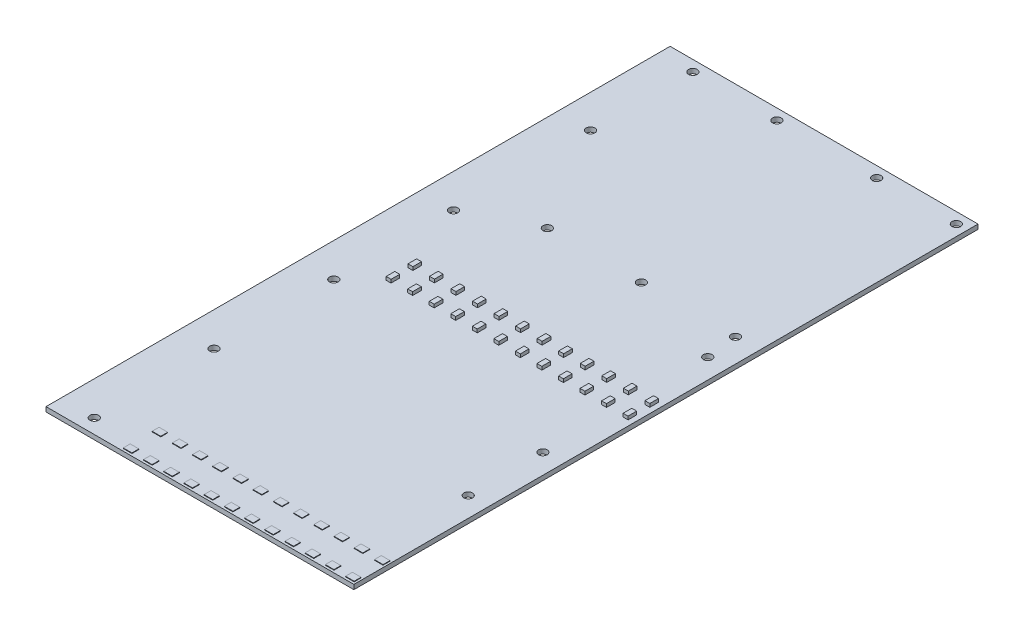
from build123d import *

# Parameters (mm, degrees)
SKETCH1_W           = 106.67
SKETCH1_H           = 216.23
BOSS_EXTRUDE1_DEPTH = 1.6
SKETCH6_W           = 3
SKETCH6_H           = 2.4
BOSS_EXTRUDE3_DEPTH = 0.2
SKETCH13_W          = 1.7
SKETCH13_H          = 3
BOSS_EXTRUDE4_DEPTH = 1.15
SKETCH14_R          = 1.5
CUT_EXTRUDE1_DEPTH  = 121.586226203
SKETCH15_R          = 1.5
CUT_EXTRUDE2_DEPTH  = 121.586226203


with BuildPart() as part:
    # Sketch1 → Boss-Extrude1 (new body)
    with BuildSketch(Plane(origin=(0, 0, 0), x_dir=(1, 0, 0), z_dir=(0, 1, 0))):
        Rectangle(SKETCH1_W, SKETCH1_H)
    extrude(amount=BOSS_EXTRUDE1_DEPTH)

    # Sketch6 → Boss-Extrude3 (add)
    with BuildSketch(Plane.XZ):
        with Locations((-25.865, 106.115)):
            Rectangle(SKETCH6_W, SKETCH6_H)
        with Locations((-25.865, 96.115)):
            Rectangle(SKETCH6_W, SKETCH6_H)
        with Locations((-18.865, 106.115)):
            Rectangle(SKETCH6_W, SKETCH6_H)
        with Locations((-18.865, 96.115)):
            Rectangle(SKETCH6_W, SKETCH6_H)
        with Locations((-11.865, 106.115)):
            Rectangle(SKETCH6_W, SKETCH6_H)
        with Locations((-11.865, 96.115)):
            Rectangle(SKETCH6_W, SKETCH6_H)
        with Locations((-4.865, 106.115)):
            Rectangle(SKETCH6_W, SKETCH6_H)
        with Locations((-4.865, 96.115)):
            Rectangle(SKETCH6_W, SKETCH6_H)
        with Locations((2.135, 106.115)):
            Rectangle(SKETCH6_W, SKETCH6_H)
        with Locations((2.135, 96.115)):
            Rectangle(SKETCH6_W, SKETCH6_H)
        with Locations((9.135, 106.115)):
            Rectangle(SKETCH6_W, SKETCH6_H)
        with Locations((9.135, 96.115)):
            Rectangle(SKETCH6_W, SKETCH6_H)
        with Locations((16.135, 106.115)):
            Rectangle(SKETCH6_W, SKETCH6_H)
        with Locations((16.135, 96.115)):
            Rectangle(SKETCH6_W, SKETCH6_H)
        with Locations((23.135, 106.115)):
            Rectangle(SKETCH6_W, SKETCH6_H)
        with Locations((23.135, 96.115)):
            Rectangle(SKETCH6_W, SKETCH6_H)
        with Locations((30.135, 106.115)):
            Rectangle(SKETCH6_W, SKETCH6_H)
        with Locations((30.135, 96.115)):
            Rectangle(SKETCH6_W, SKETCH6_H)
        with Locations((37.135, 106.115)):
            Rectangle(SKETCH6_W, SKETCH6_H)
        with Locations((37.135, 96.115)):
            Rectangle(SKETCH6_W, SKETCH6_H)
        with Locations((44.135, 106.115)):
            Rectangle(SKETCH6_W, SKETCH6_H)
        with Locations((44.135, 96.115)):
            Rectangle(SKETCH6_W, SKETCH6_H)
        with Locations((51.135, 106.115)):
            Rectangle(SKETCH6_W, SKETCH6_H)
        with Locations((51.135, 96.115)):
            Rectangle(SKETCH6_W, SKETCH6_H)
    boss_extrude3 = extrude(amount=BOSS_EXTRUDE3_DEPTH)

    # Mirror2: Boss-Extrude3 across plane
    add(boss_extrude3.mirror(Plane(origin=(0, 0.8, 0), x_dir=(0, 0, 1), z_dir=(0, -1, 0))))

    # Sketch13 → Boss-Extrude4 (add)
    with BuildSketch(Plane(origin=(0, 1.6, 0), x_dir=(1, 0, 0), z_dir=(0, 1, 0))):
        with Locations((43.161363636, -2.225)):
            Rectangle(SKETCH13_W, SKETCH13_H)
        with Locations((50.625, -2.225)):
            Rectangle(SKETCH13_W, SKETCH13_H)
        with Locations((35.697727273, -2.225)):
            Rectangle(SKETCH13_W, SKETCH13_H)
        with Locations((28.234090909, -2.225)):
            Rectangle(SKETCH13_W, SKETCH13_H)
        with Locations((20.770454545, -2.225)):
            Rectangle(SKETCH13_W, SKETCH13_H)
        with Locations((13.306818182, -2.225)):
            Rectangle(SKETCH13_W, SKETCH13_H)
        with Locations((5.843181818, -2.225)):
            Rectangle(SKETCH13_W, SKETCH13_H)
        with Locations((-1.620454545, -2.225)):
            Rectangle(SKETCH13_W, SKETCH13_H)
        with Locations((-9.084090909, -2.225)):
            Rectangle(SKETCH13_W, SKETCH13_H)
        with Locations((-16.547727273, -2.225)):
            Rectangle(SKETCH13_W, SKETCH13_H)
        with Locations((-24.011363636, -2.225)):
            Rectangle(SKETCH13_W, SKETCH13_H)
        with Locations((-31.475, -2.225)):
            Rectangle(SKETCH13_W, SKETCH13_H)
        with Locations((-31.475, -9.775)):
            Rectangle(SKETCH13_W, SKETCH13_H)
        with Locations((-24.011363636, -9.775)):
            Rectangle(SKETCH13_W, SKETCH13_H)
        with Locations((-16.547727273, -9.775)):
            Rectangle(SKETCH13_W, SKETCH13_H)
        with Locations((-9.084090909, -9.775)):
            Rectangle(SKETCH13_W, SKETCH13_H)
        with Locations((-1.620454545, -9.775)):
            Rectangle(SKETCH13_W, SKETCH13_H)
        with Locations((5.843181818, -9.775)):
            Rectangle(SKETCH13_W, SKETCH13_H)
        with Locations((13.306818182, -9.775)):
            Rectangle(SKETCH13_W, SKETCH13_H)
        with Locations((20.770454545, -9.775)):
            Rectangle(SKETCH13_W, SKETCH13_H)
        with Locations((28.234090909, -9.775)):
            Rectangle(SKETCH13_W, SKETCH13_H)
        with Locations((35.697727273, -9.775)):
            Rectangle(SKETCH13_W, SKETCH13_H)
        with Locations((43.161363636, -9.775)):
            Rectangle(SKETCH13_W, SKETCH13_H)
        with Locations((50.625, -9.775)):
            Rectangle(SKETCH13_W, SKETCH13_H)
    boss_extrude4 = extrude(amount=BOSS_EXTRUDE4_DEPTH)

    # Mirror3: Boss-Extrude4 across plane
    add(boss_extrude4.mirror(Plane(origin=(0, 0.8, 0), x_dir=(0, 0, 1), z_dir=(0, -1, 0))))

    # Sketch14 → Cut-Extrude1 (cut, through all)
    with BuildSketch(Plane(origin=(0, 1.6, 0), x_dir=(1, 0, 0), z_dir=(0, 1, 0))):
        with Locations((45.145, 32.275)):
            Circle(SKETCH14_R)
        with Locations((12.555, 32.275)):
            Circle(SKETCH14_R)
        with Locations((-20.035, 32.275)):
            Circle(SKETCH14_R)
    extrude(amount=-CUT_EXTRUDE1_DEPTH, mode=Mode.SUBTRACT)

    # Sketch15 → Cut-Extrude2 (cut, through all)
    with BuildSketch(Plane.XZ):
        with Locations((49.588, -104.365)):
            Circle(SKETCH15_R)
        with Locations((21.978, -104.365)):
            Circle(SKETCH15_R)
        with Locations((-12.591, -104.365)):
            Circle(SKETCH15_R)
        with Locations((-41.701, -104.365)):
            Circle(SKETCH15_R)
        with Locations((-41.879, -69.08)):
            Circle(SKETCH15_R)
        with Locations((-41.625, -21.373)):
            Circle(SKETCH15_R)
        with Locations((-41.625, 20.12)):
            Circle(SKETCH15_R)
        with Locations((-41.625, 61.613)):
            Circle(SKETCH15_R)
        with Locations((-41.625, 103.106)):
            Circle(SKETCH15_R)
        with Locations((46.44, -21.373)):
            Circle(SKETCH15_R)
        with Locations((46.44, 35.747)):
            Circle(SKETCH15_R)
        with Locations((46.44, 61.614)):
            Circle(SKETCH15_R)
    extrude(amount=-CUT_EXTRUDE2_DEPTH, mode=Mode.SUBTRACT)


solid = part.part
